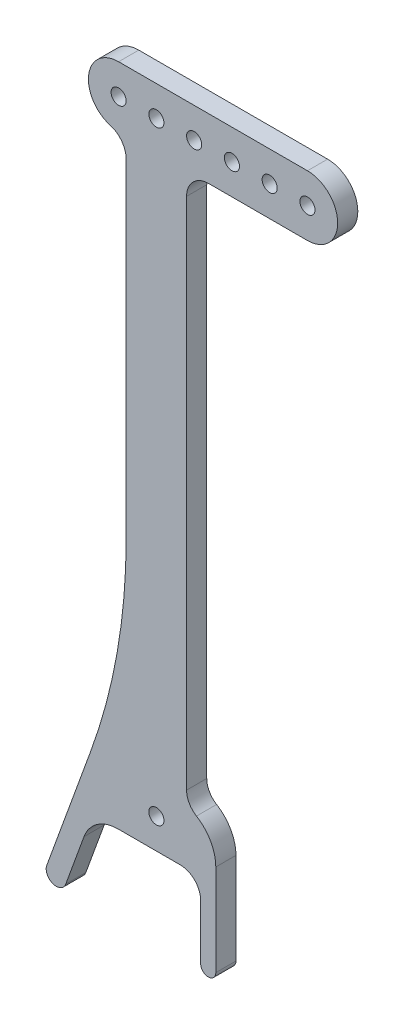
from build123d import *

# Parameters (mm, degrees)
SKETCH1_R           = 2.38125
BOSS_EXTRUDE1_DEPTH = 6.35


with BuildPart() as part:
    # Sketch1 → Boss-Extrude1 (new body)
    with BuildSketch(Plane.XY):
        with BuildLine():
            Line((0, 80.374326863), (0, 184.169856168))
            ThreePointArc((0, 184.169856168), (-1.399519198, 188.364212997), (-5.037259615, 190.877801635))
            ThreePointArc((-5.037259615, 190.877801635), (-11.811326602, 201.366372539), (-2.38125, 209.55))
            Line((-2.38125, 209.55), (57.15, 209.55))
            ThreePointArc((57.15, 209.55), (66.675, 200.025), (57.15, 190.5))
            Line((57.15, 190.5), (26.035, 190.5))
            ThreePointArc((26.035, 190.5), (21.095859133, 188.454140867), (19.05, 183.515))
            Line((19.05, 183.515), (19.05, 21.407957037))
            ThreePointArc((19.05, 21.407957037), (19.880728328, 18.234450269), (22.159817881, 15.875))
            ThreePointArc((22.159817881, 15.875), (26.628620925, 11.248626923), (28.2575, 5.026064633))
            Line((28.2575, 5.026064633), (28.2575, -23.8125))
            ThreePointArc((28.2575, -23.8125), (25.87625, -26.19375), (23.495, -23.8125))
            Line((23.495, -23.8125), (23.495, -6.477))
            ThreePointArc((23.495, -6.477), (21.597930622, -1.897069378), (17.018, 0))
            Line((17.018, 0), (-2.638551939, 0))
            ThreePointArc((-2.638551939, 0), (-9.136828191, -2.048898632), (-13.284704491, -7.45451627))
            Line((-13.284704491, -7.45451627), (-19.055961271, -23.310913955))
            ThreePointArc((-19.055961271, -23.310913955), (-23.125399297, -25.208524071), (-25.023009413, -21.139086045))
            Line((-25.023009413, -21.139086045), (-11.205694737, 16.823674026))
            ThreePointArc((-11.205694737, 16.823674026), (-2.822866527, 48.108814817), (0, 80.374326863))
        make_face()
        with Locations((9.525, 9.525)):
            Circle(SKETCH1_R, mode=Mode.SUBTRACT)
        with Locations((9.525, 200.025)):
            Circle(SKETCH1_R, mode=Mode.SUBTRACT)
        with Locations((21.43125, 200.025)):
            Circle(SKETCH1_R, mode=Mode.SUBTRACT)
        with Locations((-2.38125, 200.025)):
            Circle(SKETCH1_R, mode=Mode.SUBTRACT)
        with Locations((33.3375, 200.025)):
            Circle(SKETCH1_R, mode=Mode.SUBTRACT)
        with Locations((57.15, 200.025)):
            Circle(SKETCH1_R, mode=Mode.SUBTRACT)
        with Locations((45.24375, 200.025)):
            Circle(SKETCH1_R, mode=Mode.SUBTRACT)
    extrude(amount=BOSS_EXTRUDE1_DEPTH)


solid = part.part
